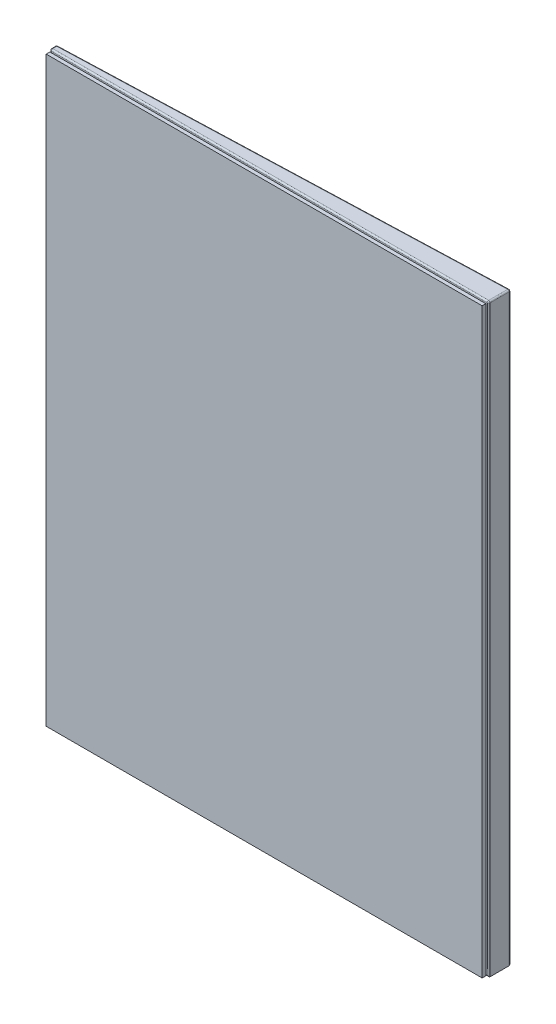
from build123d import *

# Parameters (mm, degrees)
BOSS_EXTRUDE1_DEPTH = 101.6
FILLET1_R           = 0.254
SKETCH3_W           = 73.152
SKETCH3_H           = 98.552
BOSS_EXTRUDE2_DEPTH = 0.254
SKETCH4_W           = 75.692
SKETCH4_H           = 101.092
BOSS_EXTRUDE3_DEPTH = 0.635
SKETCH5_W           = 5.245580378
SKETCH5_H           = 8.524068114
SKETCH5_H_2         = 8.524068115
SKETCH5_W_2         = 5.245580379
BOSS_EXTRUDE4_DEPTH = 0.635


with BuildPart() as part:
    # Sketch1 → Boss-Extrude1 (new body)
    with BuildSketch(Plane(origin=(0, 0, 0), x_dir=(1, 0, 0), z_dir=(0, 1, 0))):
        Polygon((0, 0), (76.2, 0), (76.2, 3.81), (0, 1.1764495), align=None)
    extrude(amount=BOSS_EXTRUDE1_DEPTH)

    # Fillet1
    fillet1_edges = [part.edges().sort_by_distance(p)[0] for p in [
        (76.2, 101.6, -1.905),
        (38.1, 101.6, -2.49322475),
        (0, 101.6, -0.58822475),
        (38.1, 0, -2.49322475),
        (38.1, 0, 0),
        (0, 0, -0.58822475),
        (38.1, 101.6, 0),
        (0, 50.8, -1.1764495),
        (76.2, 50.8, -3.81),
        (76.2, 50.8, 0),
        (0, 50.8, 0),
    ]]
    fillet(fillet1_edges, radius=FILLET1_R)

    # Sketch3 → Boss-Extrude2 (add)
    with BuildSketch(Plane.XY):
        with Locations((38.1, 50.8)):
            Rectangle(SKETCH3_W, SKETCH3_H)
    extrude(amount=BOSS_EXTRUDE2_DEPTH)

    # Sketch4 → Boss-Extrude3 (add)
    with BuildSketch(Plane.XY.offset(0.254)):
        with Locations((38.1, 50.8)):
            Rectangle(SKETCH4_W, SKETCH4_H)
    extrude(amount=BOSS_EXTRUDE3_DEPTH)

    # Sketch5 → Boss-Extrude4 (add)
    with BuildSketch(Plane(origin=(-0.040610799, 0, -1.175045949), x_dir=(-0.9994033020943162, 0, 0.034540407684001274), z_dir=(-0.034540407684001274, 0, -0.9994033020943162))):
        with Locations((-3.874536836, 96.295602006)):
            Rectangle(SKETCH5_W, SKETCH5_H)
        with Locations((-71.552678444, 95.59737493)):
            Rectangle(SKETCH5_W, SKETCH5_H_2)
        with Locations((-71.735567304, 5.801534056)):
            Rectangle(SKETCH5_W, SKETCH5_H_2)
        with Locations((-4.423527668, 5.776498119)):
            Rectangle(SKETCH5_W_2, SKETCH5_H)
    extrude(amount=BOSS_EXTRUDE4_DEPTH)


solid = part.part
